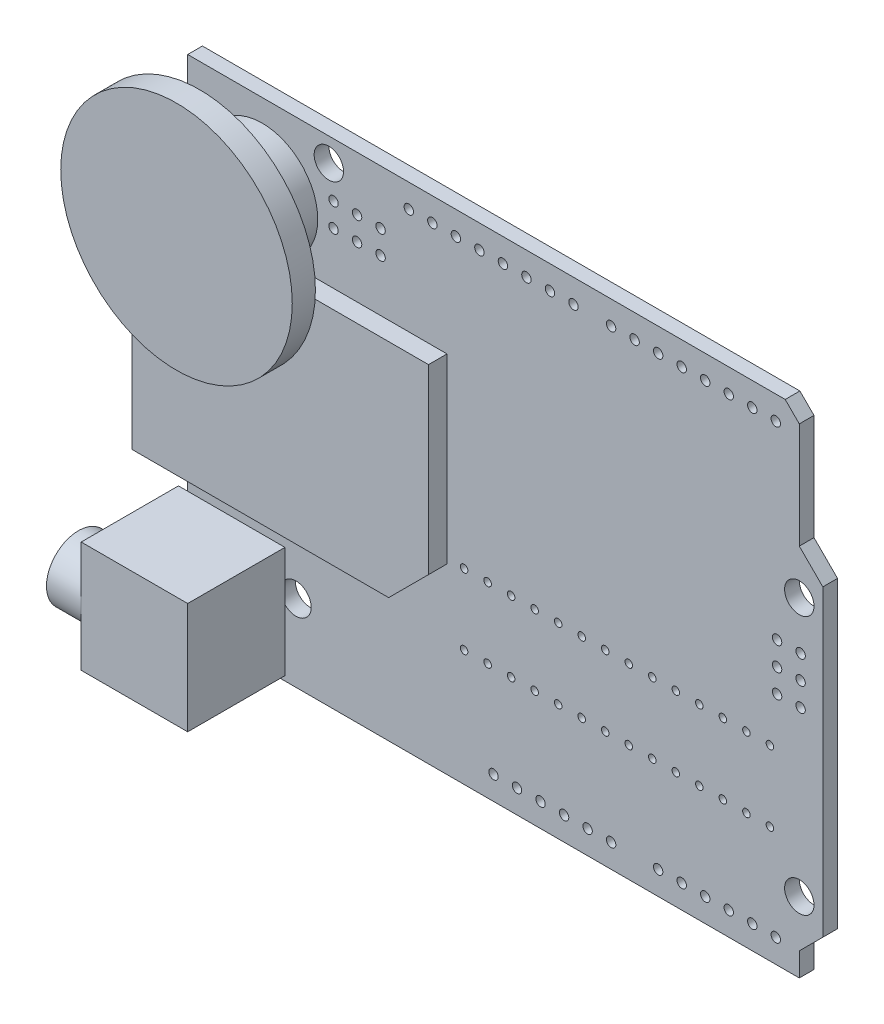
from build123d import *

# Parameters (mm, degrees)
BOSS_EXTRUDE1_DEPTH  = 1.5875
SKETCH3_R            = 1.1049
SKETCH3_R_2          = 1.651
SKETCH3_R_3          = 1.5875
SKETCH3_R_4          = 0.4826
CUT_EXTRUDE1_DEPTH   = 44.469640813
SKETCH4_R            = 0.508
SKETCH4_R_2          = 0.4064
CUT_EXTRUDE2_DEPTH   = 44.469640813
SKETCH5_W            = 11.5
SKETCH5_H            = 12
HEADPHONE_JACK_DEPTH = 10.5
SKETCH6_R            = 3.46
SKETCH6_R_2          = 1.75
HEADPHONE_PORT_DEPTH = 3.75
SKETCH7_R            = 6
KNOB_BASE_DEPTH      = 6.75
SKETCH8_R            = 12.5
VOLUME_KNOB_DEPTH    = 2.5
SD_CARD_DEPTH        = 2


with BuildPart() as part:
    # Sketch2 → Boss-Extrude1 (new body)
    with BuildSketch(Plane.XY):
        Polygon((-34.2899492, 26.67), (30.2259492, 26.67), (31.7499492, 25.146), (31.7499492, 13.716), (34.2899492, 11.176), (34.2899492, -21.59), (31.7499492, -24.13), (31.7499492, -26.67), (-34.2899492, -26.67), align=None)
    extrude(amount=-BOSS_EXTRUDE1_DEPTH)

    # Sketch3 → Cut-Extrude1 (cut, through all)
    with BuildSketch(Plane.XY):
        with Locations((-30.4799492, 17.429988)):
            Circle(SKETCH3_R)
        with Locations((-30.4799492, 5.430012)):
            Circle(SKETCH3_R)
        with Locations((-28.6003492, -18.3642)):
            Circle(SKETCH3_R_2)
        with Locations((-25.6031492, -23.368)):
            Circle(SKETCH3_R_2)
        with Locations((-22.6060508, -18.3642)):
            Circle(SKETCH3_R_2)
        with Locations((31.7499492, -19.05)):
            Circle(SKETCH3_R_3)
        with Locations((31.7499492, 8.89)):
            Circle(SKETCH3_R_3)
        with Locations((-19.0500508, 24.13)):
            Circle(SKETCH3_R_3)
        with Locations((-25.769951, 12.679934)):
            Circle(SKETCH3_R_4)
        with Locations((-27.769947, 12.679934)):
            Circle(SKETCH3_R_4)
        with Locations((-27.769947, 10.180066)):
            Circle(SKETCH3_R_4)
        with Locations((-25.769951, 10.180066)):
            Circle(SKETCH3_R_4)
    extrude(amount=-CUT_EXTRUDE1_DEPTH, mode=Mode.SUBTRACT)

    # Sketch4 → Cut-Extrude2 (cut, through all)
    with BuildSketch(Plane.XY):
        with Locations((29.2099492, 24.13)):
            Circle(SKETCH4_R)
        with Locations((26.6699492, 24.13)):
            Circle(SKETCH4_R)
        with Locations((24.1299492, 24.13)):
            Circle(SKETCH4_R)
        with Locations((21.5899492, 24.13)):
            Circle(SKETCH4_R)
        with Locations((19.0499492, 24.13)):
            Circle(SKETCH4_R)
        with Locations((16.5099492, 24.13)):
            Circle(SKETCH4_R)
        with Locations((13.9699492, 24.13)):
            Circle(SKETCH4_R)
        with Locations((11.4299492, 24.13)):
            Circle(SKETCH4_R)
        with Locations((7.3659492, 24.13)):
            Circle(SKETCH4_R)
        with Locations((4.8259492, 24.13)):
            Circle(SKETCH4_R)
        with Locations((2.2859492, 24.13)):
            Circle(SKETCH4_R)
        with Locations((-0.2540508, 24.13)):
            Circle(SKETCH4_R)
        with Locations((-2.7940508, 24.13)):
            Circle(SKETCH4_R)
        with Locations((-5.3340508, 24.13)):
            Circle(SKETCH4_R)
        with Locations((-7.8740508, 24.13)):
            Circle(SKETCH4_R)
        with Locations((-10.4140508, 24.13)):
            Circle(SKETCH4_R)
        with Locations((28.5749492, -6.477)):
            Circle(SKETCH4_R_2)
        with Locations((26.0349492, -6.477)):
            Circle(SKETCH4_R_2)
        with Locations((23.4949492, -6.477)):
            Circle(SKETCH4_R_2)
        with Locations((20.9549492, -6.477)):
            Circle(SKETCH4_R_2)
        with Locations((18.4149492, -6.477)):
            Circle(SKETCH4_R_2)
        with Locations((15.8749492, -6.477)):
            Circle(SKETCH4_R_2)
        with Locations((13.3349492, -6.477)):
            Circle(SKETCH4_R_2)
        with Locations((10.7949492, -6.477)):
            Circle(SKETCH4_R_2)
        with Locations((8.2549492, -6.477)):
            Circle(SKETCH4_R_2)
        with Locations((5.7149492, -6.477)):
            Circle(SKETCH4_R_2)
        with Locations((3.1749492, -6.477)):
            Circle(SKETCH4_R_2)
        with Locations((0.6349492, -6.477)):
            Circle(SKETCH4_R_2)
        with Locations((-1.9050508, -6.477)):
            Circle(SKETCH4_R_2)
        with Locations((-4.4450508, -6.477)):
            Circle(SKETCH4_R_2)
        with Locations((28.5749492, -14.097)):
            Circle(SKETCH4_R_2)
        with Locations((26.0349492, -14.097)):
            Circle(SKETCH4_R_2)
        with Locations((23.4949492, -14.097)):
            Circle(SKETCH4_R_2)
        with Locations((20.9549492, -14.097)):
            Circle(SKETCH4_R_2)
        with Locations((18.4149492, -14.097)):
            Circle(SKETCH4_R_2)
        with Locations((15.8749492, -14.097)):
            Circle(SKETCH4_R_2)
        with Locations((13.3349492, -14.097)):
            Circle(SKETCH4_R_2)
        with Locations((10.7949492, -14.097)):
            Circle(SKETCH4_R_2)
        with Locations((8.2549492, -14.097)):
            Circle(SKETCH4_R_2)
        with Locations((5.7149492, -14.097)):
            Circle(SKETCH4_R_2)
        with Locations((3.1749492, -14.097)):
            Circle(SKETCH4_R_2)
        with Locations((0.6349492, -14.097)):
            Circle(SKETCH4_R_2)
        with Locations((-1.9050508, -14.097)):
            Circle(SKETCH4_R_2)
        with Locations((-4.4450508, -14.097)):
            Circle(SKETCH4_R_2)
        with Locations((29.2099492, -24.13)):
            Circle(SKETCH4_R)
        with Locations((11.4299492, -24.13)):
            Circle(SKETCH4_R)
        with Locations((26.6699492, -24.13)):
            Circle(SKETCH4_R)
        with Locations((8.8899492, -24.13)):
            Circle(SKETCH4_R)
        with Locations((24.1299492, -24.13)):
            Circle(SKETCH4_R)
        with Locations((6.3499492, -24.13)):
            Circle(SKETCH4_R)
        with Locations((21.5899492, -24.13)):
            Circle(SKETCH4_R)
        with Locations((3.8099492, -24.13)):
            Circle(SKETCH4_R)
        with Locations((19.0499492, -24.13)):
            Circle(SKETCH4_R)
        with Locations((1.2699492, -24.13)):
            Circle(SKETCH4_R)
        with Locations((16.5099492, -24.13)):
            Circle(SKETCH4_R)
        with Locations((-1.2700508, -24.13)):
            Circle(SKETCH4_R)
        with Locations((-13.4620508, 20.828)):
            Circle(SKETCH4_R)
        with Locations((-13.4620508, 18.288)):
            Circle(SKETCH4_R)
        with Locations((-16.0020508, 18.288)):
            Circle(SKETCH4_R)
        with Locations((-16.0020508, 20.828)):
            Circle(SKETCH4_R)
        with Locations((-18.5420508, 18.288)):
            Circle(SKETCH4_R)
        with Locations((-18.5420508, 20.828)):
            Circle(SKETCH4_R)
        with Locations((31.8901572, -1.320038)):
            Circle(SKETCH4_R)
        with Locations((29.3501572, -1.320038)):
            Circle(SKETCH4_R)
        with Locations((29.3501572, 1.219962)):
            Circle(SKETCH4_R)
        with Locations((31.8901572, 1.219962)):
            Circle(SKETCH4_R)
        with Locations((29.3501572, 3.759962)):
            Circle(SKETCH4_R)
        with Locations((31.8901572, 3.759962)):
            Circle(SKETCH4_R)
    extrude(amount=-CUT_EXTRUDE2_DEPTH, mode=Mode.SUBTRACT)


with BuildPart() as body_2:
    # Sketch5 → headphone_jack (new body)
    with BuildSketch(Plane.XY):
        with Locations((-29.5399492, -20.17)):
            Rectangle(SKETCH5_W, SKETCH5_H)
    extrude(amount=HEADPHONE_JACK_DEPTH)

    # Sketch6 → headphone_port (add)
    with BuildSketch(Plane.ZY.offset(35.2899492)):
        with Locations((7.04, -20.17)):
            Circle(SKETCH6_R)
        with Locations((7.04, -20.17)):
            Circle(SKETCH6_R_2, mode=Mode.SUBTRACT)
    extrude(amount=HEADPHONE_PORT_DEPTH)


with BuildPart() as body_3:
    # Sketch7 → knob_base (new body)
    with BuildSketch(Plane.XY):
        with Locations((-26.249599131, 18.279124524)):
            Circle(SKETCH7_R)
    extrude(amount=KNOB_BASE_DEPTH)

    # Sketch8 → volume_knob (add)
    with BuildSketch(Plane.XY.offset(6.75)):
        with Locations((-26.249599131, 18.279124524)):
            Circle(SKETCH8_R)
    extrude(amount=VOLUME_KNOB_DEPTH)


with BuildPart() as body_4:
    # Sketch9 → sd_card (new body)
    with BuildSketch(Plane.XY):
        Polygon((-6.2899492, -6.97), (-10.5899492, -11.27), (-38.2899492, -11.27), (-38.2899492, 12.67), (-6.2899492, 12.67), align=None)
    extrude(amount=SD_CARD_DEPTH)


solid = Compound([part.part, body_2.part, body_3.part, body_4.part])
